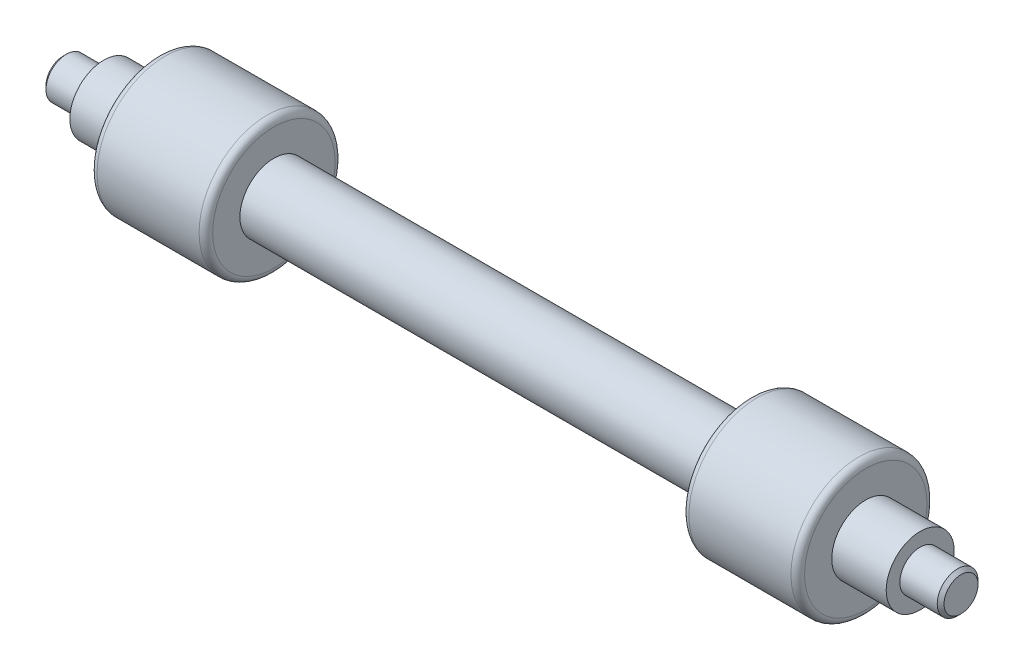
from build123d import *

# Parameters (mm, degrees)
SKETCH2_W     = 8.5
SKETCH2_H     = 2.5
FILLET1_R     = 0.5
FILLET2_R     = 0.5
CHAMFER1_SIZE = 0.25


with BuildPart() as part:
    # Sketch1 → Revolve1 (revolve)
    with BuildSketch(Plane.XY, mode=Mode.PRIVATE) as revolve1_sk:
        Polygon((33, 0), (33, 1.5), (30, 1.5), (30, 2.5), (-30, 2.5), (-30, 1.5), (-33, 1.5), (-33, 0), align=None)
    revolve(revolve1_sk.sketch.rotate(Axis((-35.808977143, 0, 0), (1, 0, 0)), 90), axis=Axis((-35.808977143, 0, 0), (1, 0, 0)))

    # Chamfer1
    chamfer1_edges = [part.edges().sort_by_distance(p)[0] for p in [
        (-33, 0, -1.5),
        (33, 0, -1.5),
    ]]
    chamfer(chamfer1_edges, length=CHAMFER1_SIZE)


with BuildPart() as body_2:
    # Sketch2 → Revolve2 (revolve)
    with BuildSketch(Plane.XY, mode=Mode.PRIVATE) as revolve2_sk:
        with Locations((-21.75, 3.75)):
            Rectangle(SKETCH2_W, SKETCH2_H)
        with Locations((21.75, 3.75)):
            Rectangle(SKETCH2_W, SKETCH2_H)
    revolve(revolve2_sk.sketch.rotate(Axis((-35.808977143, 0, 0), (1, 0, 0)), 90), axis=Axis((-35.808977143, 0, 0), (1, 0, 0)))

    # Fillet1
    fillet1_edges = [body_2.edges().sort_by_distance(p)[0] for p in [
        (-17.5, 0, -5),
        (-26, 0, -5),
    ]]
    fillet(fillet1_edges, radius=FILLET1_R)

    # Fillet2
    fillet2_edges = [body_2.edges().sort_by_distance(p)[0] for p in [
        (26, 0, -5),
        (17.5, 0, -5),
    ]]
    fillet(fillet2_edges, radius=FILLET2_R)


solid = Compound([part.part, body_2.part])
